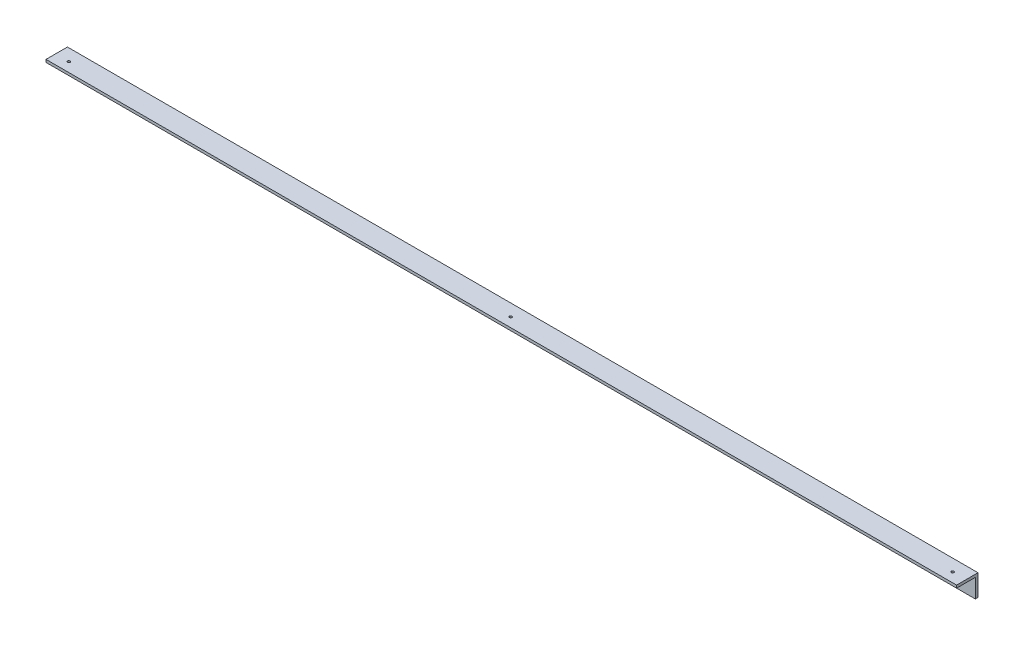
from build123d import *

# Parameters (mm, degrees)
CROQUIS1_R              = 4.7625
CROQUIS1_R_2            = 4.765
SALIENTE_EXTRUIR1_DEPTH = 10
CROQUIS2_W              = 3400
CROQUIS2_H              = 10
SALIENTE_EXTRUIR2_DEPTH = 70
CROQUIS3_R              = 4.7625
CORTAR_EXTRUIR1_DEPTH   = 3352.686142824


with BuildPart() as part:
    # Croquis1 → Saliente-Extruir1 (new body)
    with BuildSketch(Plane.XY):
        Polygon((-50, 0), (-50, -40), (3350, -40), (3350, 40), (-50, 40), align=None)
        Circle(CROQUIS1_R, mode=Mode.SUBTRACT)
        with Locations((1650, 0)):
            Circle(CROQUIS1_R_2, mode=Mode.SUBTRACT)
        with Locations((3300, 0)):
            Circle(CROQUIS1_R_2, mode=Mode.SUBTRACT)
    extrude(amount=SALIENTE_EXTRUIR1_DEPTH)

    # Croquis2 → Saliente-Extruir2 (add)
    with BuildSketch(Plane.XY.offset(10)):
        with Locations((1650, 35)):
            Rectangle(CROQUIS2_W, CROQUIS2_H)
    extrude(amount=SALIENTE_EXTRUIR2_DEPTH)

    # Croquis3 → Cortar-Extruir1 (cut, through all)
    with BuildSketch(Plane.XZ.offset(-30)):
        with Locations((3300, 45)):
            Circle(CROQUIS3_R)
        with Locations((1650, 45)):
            Circle(CROQUIS3_R)
        with Locations((0, 45)):
            Circle(CROQUIS3_R)
    extrude(amount=-CORTAR_EXTRUIR1_DEPTH, mode=Mode.SUBTRACT)


solid = part.part
